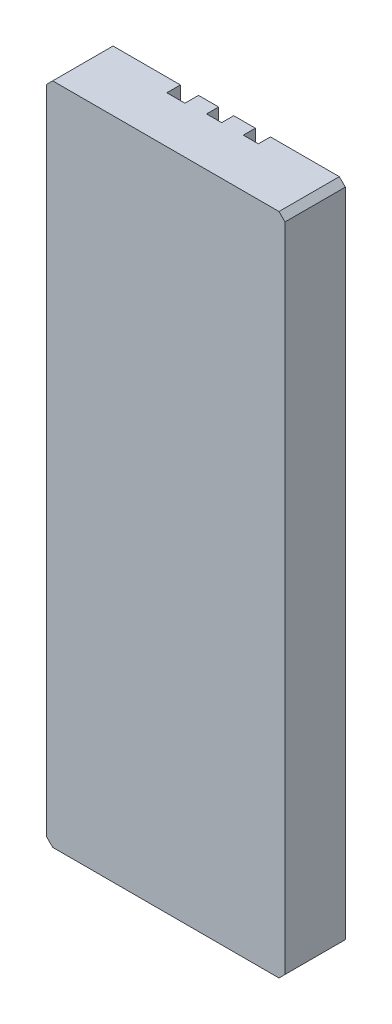
from build123d import *

# Parameters (mm, degrees)
SKETCH1_W           = 79
SKETCH1_H           = 220
BOSS_EXTRUDE1_DEPTH = 20
SKETCH2_W           = 6
SKETCH2_H           = 6
CUT_EXTRUDE1_DEPTH  = 76
SKETCH3_W           = 5
SKETCH3_H           = 5
CUT_EXTRUDE2_DEPTH  = 189
SKETCH4_W           = 5
SKETCH4_H           = 5
CUT_EXTRUDE3_DEPTH  = 100
SKETCH5_W           = 10
SKETCH5_H           = 25
CUT_EXTRUDE4_DEPTH  = 4
FILLET1_R           = 2
SKETCH6_W           = 11
SKETCH6_H           = 25
CUT_EXTRUDE5_DEPTH  = 4.5
FILLET2_R           = 2
SKETCH7_W           = 14
SKETCH7_H           = 35
CUT_EXTRUDE6_DEPTH  = 4
FILLET3_R           = 2
CHAMFER1_SIZE       = 2


with BuildPart() as part:
    # Sketch1 → Boss-Extrude1 (new body)
    with BuildSketch(Plane.XY):
        with Locations((-21, -169)):
            Rectangle(SKETCH1_W, SKETCH1_H)
    extrude(amount=-BOSS_EXTRUDE1_DEPTH)

    # Sketch2 → Cut-Extrude1 (cut)
    with BuildSketch(Plane(origin=(0, -59, 0), x_dir=(1, 0, 0), z_dir=(0, 1, 0))):
        with Locations((-33.166666667, 18.5)):
            Rectangle(SKETCH2_W, SKETCH2_H)
    extrude(amount=-CUT_EXTRUDE1_DEPTH, mode=Mode.SUBTRACT)

    # Sketch3 → Cut-Extrude2 (cut)
    with BuildSketch(Plane(origin=(0, -59, 0), x_dir=(1, 0, 0), z_dir=(0, 1, 0))):
        with Locations((-21.001666667, 18.5)):
            Rectangle(SKETCH3_W, SKETCH3_H)
    extrude(amount=-CUT_EXTRUDE2_DEPTH, mode=Mode.SUBTRACT)

    # Sketch4 → Cut-Extrude3 (cut)
    with BuildSketch(Plane(origin=(0, -59, 0), x_dir=(1, 0, 0), z_dir=(0, 1, 0))):
        with Locations((-8.835, 18.5)):
            Rectangle(SKETCH4_W, SKETCH4_H)
    extrude(amount=-CUT_EXTRUDE3_DEPTH, mode=Mode.SUBTRACT)

    # Sketch5 → Cut-Extrude4 (cut)
    with BuildSketch(Plane(origin=(0, 0, -20), x_dir=(-1, 0, 0), z_dir=(0, 0, -1))):
        with Locations((8.835, -146.496976588)):
            Rectangle(SKETCH5_W, SKETCH5_H)
    extrude(amount=-CUT_EXTRUDE4_DEPTH, mode=Mode.SUBTRACT)

    # Fillet1
    fillet1_edges = [part.edges().sort_by_distance(p)[0] for p in [
        (-13.835, -158.996976588, -18),
        (-3.835, -133.996976588, -18),
        (-13.835, -133.996976588, -18),
        (-3.835, -158.996976588, -18),
    ]]
    fillet(fillet1_edges, radius=FILLET1_R)

    # Sketch6 → Cut-Extrude5 (cut)
    with BuildSketch(Plane(origin=(0, 0, -20), x_dir=(-1, 0, 0), z_dir=(0, 0, -1))):
        with Locations((33.166666667, -122.5)):
            Rectangle(SKETCH6_W, SKETCH6_H)
    extrude(amount=-CUT_EXTRUDE5_DEPTH, mode=Mode.SUBTRACT)

    # Fillet2
    fillet2_edges = [part.edges().sort_by_distance(p)[0] for p in [
        (-38.666666667, -135, -17.75),
        (-27.666666667, -110, -17.75),
        (-38.666666667, -110, -17.75),
        (-27.666666667, -135, -17.75),
    ]]
    fillet(fillet2_edges, radius=FILLET2_R)

    # Sketch7 → Cut-Extrude6 (cut)
    with BuildSketch(Plane(origin=(0, 0, -20), x_dir=(-1, 0, 0), z_dir=(0, 0, -1))):
        with Locations((21.001666667, -252)):
            Rectangle(SKETCH7_W, SKETCH7_H)
    extrude(amount=-CUT_EXTRUDE6_DEPTH, mode=Mode.SUBTRACT)

    # Fillet3
    fillet3_edges = [part.edges().sort_by_distance(p)[0] for p in [
        (-14.001666667, -234.5, -18),
        (-14.001666667, -269.5, -18),
        (-28.001666667, -269.5, -18),
        (-28.001666667, -234.5, -18),
    ]]
    fillet(fillet3_edges, radius=FILLET3_R)

    # Chamfer1
    chamfer1_edges = [part.edges().sort_by_distance(p)[0] for p in [
        (18.5, -279, -10),
        (-60.5, -279, -10),
        (-60.5, -59, -10),
        (18.5, -59, -10),
    ]]
    chamfer(chamfer1_edges, length=CHAMFER1_SIZE)


solid = part.part
